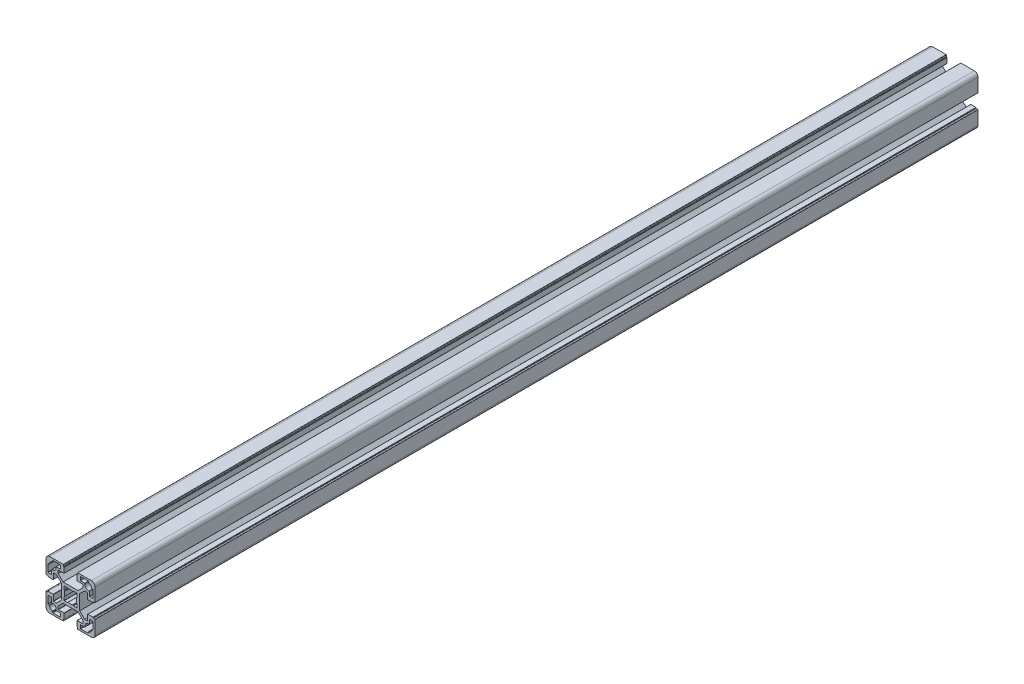
from build123d import *

# Parameters (mm, degrees)
EXTRUDE_707_DEPTH = 360


with BuildPart() as part:
    # Model → Extrude 707 (new, symmetric)
    with BuildSketch(Plane.XY):
        with BuildLine():
            Line((7.5, 6.0858), (11.4642, 10.05))
            Line((11.4642, 10.05), (13.8, 10.05))
            ThreePointArc((13.8, 10.05), (13.941421356, 9.991421356), (14, 9.85))
            Line((14, 9.85), (14, 5.35))
            ThreePointArc((14, 5.35), (14.058578644, 5.208578644), (14.2, 5.15))
            Line((14.2, 5.15), (18.3, 5.15))
            ThreePointArc((18.3, 5.15), (18.441421356, 5.208578644), (18.5, 5.35))
            Line((18.5, 5.35), (18.5, 5.6))
            ThreePointArc((18.5, 5.6), (18.558578644, 5.741421356), (18.7, 5.8))
            Line((18.7, 5.8), (19.8, 5.8))
            ThreePointArc((19.8, 5.8), (19.941421356, 5.858578644), (20, 6))
            Line((20, 6), (20, 17))
            ThreePointArc((20, 17), (19.121320344, 19.121320344), (17, 20))
            Line((17, 20), (6, 20))
            ThreePointArc((6, 20), (5.858578644, 19.941421356), (5.8, 19.8))
            Line((5.8, 19.8), (5.8, 18.7))
            ThreePointArc((5.8, 18.7), (5.741421356, 18.558578644), (5.6, 18.5))
            Line((5.6, 18.5), (5.35, 18.5))
            ThreePointArc((5.35, 18.5), (5.208578644, 18.441421356), (5.15, 18.3))
            Line((5.15, 18.3), (5.15, 14.2))
            ThreePointArc((5.15, 14.2), (5.208578644, 14.058578644), (5.35, 14))
            Line((5.35, 14), (9.85, 14))
            ThreePointArc((9.85, 14), (9.991421356, 13.941421356), (10.05, 13.8))
            Line((10.05, 13.8), (10.05, 11.4642))
            Line((10.05, 11.4642), (6.0858, 7.5))
            Line((6.0858, 7.5), (-6.0858, 7.5))
            Line((-6.0858, 7.5), (-10.05, 11.4642))
            Line((-10.05, 11.4642), (-10.05, 13.8))
            ThreePointArc((-10.05, 13.8), (-9.991421356, 13.941421356), (-9.85, 14))
            Line((-9.85, 14), (-5.35, 14))
            ThreePointArc((-5.35, 14), (-5.208578644, 14.058578644), (-5.15, 14.2))
            Line((-5.15, 14.2), (-5.15, 18.3))
            ThreePointArc((-5.15, 18.3), (-5.208578644, 18.441421356), (-5.35, 18.5))
            Line((-5.35, 18.5), (-5.6, 18.5))
            ThreePointArc((-5.6, 18.5), (-5.741421356, 18.558578644), (-5.8, 18.7))
            Line((-5.8, 18.7), (-5.8, 19.8))
            ThreePointArc((-5.8, 19.8), (-5.858578644, 19.941421356), (-6, 20))
            Line((-6, 20), (-17, 20))
            ThreePointArc((-17, 20), (-19.121320344, 19.121320344), (-20, 17))
            Line((-20, 17), (-20, 6))
            ThreePointArc((-20, 6), (-19.941421356, 5.858578644), (-19.8, 5.8))
            Line((-19.8, 5.8), (-18.7, 5.8))
            ThreePointArc((-18.7, 5.8), (-18.558578644, 5.741421356), (-18.5, 5.6))
            Line((-18.5, 5.6), (-18.5, 5.35))
            ThreePointArc((-18.5, 5.35), (-18.441421356, 5.208578644), (-18.3, 5.15))
            Line((-18.3, 5.15), (-14.2, 5.15))
            ThreePointArc((-14.2, 5.15), (-14.058578644, 5.208578644), (-14, 5.35))
            Line((-14, 5.35), (-14, 9.85))
            ThreePointArc((-14, 9.85), (-13.941421356, 9.991421356), (-13.8, 10.05))
            Line((-13.8, 10.05), (-11.4642, 10.05))
            Line((-11.4642, 10.05), (-7.5, 6.0858))
            Line((-7.5, 6.0858), (-7.5, -6.0858))
            Line((-7.5, -6.0858), (-11.4642, -10.05))
            Line((-11.4642, -10.05), (-13.8, -10.05))
            ThreePointArc((-13.8, -10.05), (-13.941421356, -9.991421356), (-14, -9.85))
            Line((-14, -9.85), (-14, -5.35))
            ThreePointArc((-14, -5.35), (-14.058578644, -5.208578644), (-14.2, -5.15))
            Line((-14.2, -5.15), (-18.3, -5.15))
            ThreePointArc((-18.3, -5.15), (-18.441421356, -5.208578644), (-18.5, -5.35))
            Line((-18.5, -5.35), (-18.5, -5.6))
            ThreePointArc((-18.5, -5.6), (-18.558578644, -5.741421356), (-18.7, -5.8))
            Line((-18.7, -5.8), (-19.8, -5.8))
            ThreePointArc((-19.8, -5.8), (-19.941421356, -5.858578644), (-20, -6))
            Line((-20, -6), (-20, -17))
            ThreePointArc((-20, -17), (-19.121320344, -19.121320344), (-17, -20))
            Line((-17, -20), (-6, -20))
            ThreePointArc((-6, -20), (-5.858578644, -19.941421356), (-5.8, -19.8))
            Line((-5.8, -19.8), (-5.8, -18.7))
            ThreePointArc((-5.8, -18.7), (-5.741421356, -18.558578644), (-5.6, -18.5))
            Line((-5.6, -18.5), (-5.35, -18.5))
            ThreePointArc((-5.35, -18.5), (-5.208578644, -18.441421356), (-5.15, -18.3))
            Line((-5.15, -18.3), (-5.15, -14.2))
            ThreePointArc((-5.15, -14.2), (-5.208578644, -14.058578644), (-5.35, -14))
            Line((-5.35, -14), (-9.85, -14))
            ThreePointArc((-9.85, -14), (-9.991421356, -13.941421356), (-10.05, -13.8))
            Line((-10.05, -13.8), (-10.05, -11.4642))
            Line((-10.05, -11.4642), (-6.0858, -7.5))
            Line((-6.0858, -7.5), (6.0858, -7.5))
            Line((6.0858, -7.5), (10.05, -11.4642))
            Line((10.05, -11.4642), (10.05, -13.8))
            ThreePointArc((10.05, -13.8), (9.991421356, -13.941421356), (9.85, -14))
            Line((9.85, -14), (5.35, -14))
            ThreePointArc((5.35, -14), (5.208578644, -14.058578644), (5.15, -14.2))
            Line((5.15, -14.2), (5.15, -18.3))
            ThreePointArc((5.15, -18.3), (5.208578644, -18.441421356), (5.35, -18.5))
            Line((5.35, -18.5), (5.6, -18.5))
            ThreePointArc((5.6, -18.5), (5.741421356, -18.558578644), (5.8, -18.7))
            Line((5.8, -18.7), (5.8, -19.8))
            ThreePointArc((5.8, -19.8), (5.858578644, -19.941421356), (6, -20))
            Line((6, -20), (17, -20))
            ThreePointArc((17, -20), (19.121320344, -19.121320344), (20, -17))
            Line((20, -17), (20, -6))
            ThreePointArc((20, -6), (19.941421356, -5.858578644), (19.8, -5.8))
            Line((19.8, -5.8), (18.7, -5.8))
            ThreePointArc((18.7, -5.8), (18.558578644, -5.741421356), (18.5, -5.6))
            Line((18.5, -5.6), (18.5, -5.35))
            ThreePointArc((18.5, -5.35), (18.441421356, -5.208578644), (18.3, -5.15))
            Line((18.3, -5.15), (14.2, -5.15))
            ThreePointArc((14.2, -5.15), (14.058578644, -5.208578644), (14, -5.35))
            Line((14, -5.35), (14, -9.85))
            ThreePointArc((14, -9.85), (13.941421356, -9.991421356), (13.8, -10.05))
            Line((13.8, -10.05), (11.4642, -10.05))
            Line((11.4642, -10.05), (7.5, -6.0858))
            Line((7.5, -6.0858), (7.5, 6.0858))
        make_face()
        with BuildLine():
            Line((15.7, -8), (18.3, -8))
            ThreePointArc((18.3, -8), (18.441421356, -8.058578644), (18.5, -8.2))
            Line((18.5, -8.2), (18.5, -14.3))
            ThreePointArc((18.5, -14.3), (18.441421356, -14.441421356), (18.3, -14.5))
            Line((18.3, -14.5), (17.443212531, -14.5))
            ThreePointArc((17.443212531, -14.5), (17.306669249, -14.55386331), (17.243672698, -14.686440678))
            ThreePointArc((17.243672698, -14.686440678), (16.444543648, -16.444543648), (14.686440678, -17.243672698))
            ThreePointArc((14.686440678, -17.243672698), (14.55386331, -17.306669249), (14.5, -17.443212531))
            Line((14.5, -17.443212531), (14.5, -18.3))
            ThreePointArc((14.5, -18.3), (14.441421356, -18.441421356), (14.3, -18.5))
            Line((14.3, -18.5), (8.2, -18.5))
            ThreePointArc((8.2, -18.5), (8.058578644, -18.441421356), (8, -18.3))
            Line((8, -18.3), (8, -15.7))
            ThreePointArc((8, -15.7), (8.058578644, -15.558578644), (8.2, -15.5))
            Line((8.2, -15.5), (11.55, -15.5))
            ThreePointArc((11.55, -15.5), (11.691421356, -15.441421356), (11.75, -15.3))
            Line((11.75, -15.3), (11.75, -14.5))
            ThreePointArc((11.75, -14.5), (12.555456352, -12.555456352), (14.5, -11.75))
            Line((14.5, -11.75), (15.3, -11.75))
            ThreePointArc((15.3, -11.75), (15.441421356, -11.691421356), (15.5, -11.55))
            Line((15.5, -11.55), (15.5, -8.2))
            ThreePointArc((15.5, -8.2), (15.558578644, -8.058578644), (15.7, -8))
        make_face(mode=Mode.SUBTRACT)
        with BuildLine():
            Line((-18.3, -8), (-15.7, -8))
            ThreePointArc((-15.7, -8), (-15.558578644, -8.058578644), (-15.5, -8.2))
            Line((-15.5, -8.2), (-15.5, -11.55))
            ThreePointArc((-15.5, -11.55), (-15.441421356, -11.691421356), (-15.3, -11.75))
            Line((-15.3, -11.75), (-14.5, -11.75))
            ThreePointArc((-14.5, -11.75), (-12.555456352, -12.555456352), (-11.75, -14.5))
            Line((-11.75, -14.5), (-11.75, -15.3))
            ThreePointArc((-11.75, -15.3), (-11.691421356, -15.441421356), (-11.55, -15.5))
            Line((-11.55, -15.5), (-8.2, -15.5))
            ThreePointArc((-8.2, -15.5), (-8.058578644, -15.558578644), (-8, -15.7))
            Line((-8, -15.7), (-8, -18.3))
            ThreePointArc((-8, -18.3), (-8.058578644, -18.441421356), (-8.2, -18.5))
            Line((-8.2, -18.5), (-14.3, -18.5))
            ThreePointArc((-14.3, -18.5), (-14.441421356, -18.441421356), (-14.5, -18.3))
            Line((-14.5, -18.3), (-14.5, -17.443212531))
            ThreePointArc((-14.5, -17.443212531), (-14.55386331, -17.306669249), (-14.686440678, -17.243672698))
            ThreePointArc((-14.686440678, -17.243672698), (-16.444543648, -16.444543648), (-17.243672698, -14.686440678))
            ThreePointArc((-17.243672698, -14.686440678), (-17.306669249, -14.55386331), (-17.443212531, -14.5))
            Line((-17.443212531, -14.5), (-18.3, -14.5))
            ThreePointArc((-18.3, -14.5), (-18.441421356, -14.441421356), (-18.5, -14.3))
            Line((-18.5, -14.3), (-18.5, -8.2))
            ThreePointArc((-18.5, -8.2), (-18.441421356, -8.058578644), (-18.3, -8))
        make_face(mode=Mode.SUBTRACT)
        with BuildLine():
            Line((-5, 5.2), (-2.261, 5.2))
            Line((-2.261, 5.2), (-2.071925246, 4.765191727))
            ThreePointArc((-2.071925246, 4.765191727), (-1.965379386, 4.66030673), (-1.815880292, 4.658602662))
            ThreePointArc((-1.815880292, 4.658602662), (0, 5), (1.815880292, 4.658602662))
            ThreePointArc((1.815880292, 4.658602662), (1.965379386, 4.66030673), (2.071925246, 4.765191727))
            Line((2.071925246, 4.765191727), (2.261, 5.2))
            Line((2.261, 5.2), (5, 5.2))
            ThreePointArc((5, 5.2), (5.141421356, 5.141421356), (5.2, 5))
            Line((5.2, 5), (5.2, 2.261))
            Line((5.2, 2.261), (4.765191727, 2.071925246))
            ThreePointArc((4.765191727, 2.071925246), (4.66030673, 1.965379386), (4.658602662, 1.815880292))
            ThreePointArc((4.658602662, 1.815880292), (5, 0), (4.658602662, -1.815880292))
            ThreePointArc((4.658602662, -1.815880292), (4.66030673, -1.965379386), (4.765191727, -2.071925246))
            Line((4.765191727, -2.071925246), (5.2, -2.261))
            Line((5.2, -2.261), (5.2, -5))
            ThreePointArc((5.2, -5), (5.141421356, -5.141421356), (5, -5.2))
            Line((5, -5.2), (2.261, -5.2))
            Line((2.261, -5.2), (2.071925246, -4.765191727))
            ThreePointArc((2.071925246, -4.765191727), (1.965379386, -4.66030673), (1.815880292, -4.658602662))
            ThreePointArc((1.815880292, -4.658602662), (0, -5), (-1.815880292, -4.658602662))
            ThreePointArc((-1.815880292, -4.658602662), (-1.965379386, -4.66030673), (-2.071925246, -4.765191727))
            Line((-2.071925246, -4.765191727), (-2.261, -5.2))
            Line((-2.261, -5.2), (-5, -5.2))
            ThreePointArc((-5, -5.2), (-5.141421356, -5.141421356), (-5.2, -5))
            Line((-5.2, -5), (-5.2, -2.261))
            Line((-5.2, -2.261), (-4.765191727, -2.071925246))
            ThreePointArc((-4.765191727, -2.071925246), (-4.66030673, -1.965379386), (-4.658602662, -1.815880292))
            ThreePointArc((-4.658602662, -1.815880292), (-5, 0), (-4.658602662, 1.815880292))
            ThreePointArc((-4.658602662, 1.815880292), (-4.66030673, 1.965379386), (-4.765191727, 2.071925246))
            Line((-4.765191727, 2.071925246), (-5.2, 2.261))
            Line((-5.2, 2.261), (-5.2, 5))
            ThreePointArc((-5.2, 5), (-5.141421356, 5.141421356), (-5, 5.2))
        make_face(mode=Mode.SUBTRACT)
        with BuildLine():
            Line((11.55, 15.5), (8.2, 15.5))
            ThreePointArc((8.2, 15.5), (8.058578644, 15.558578644), (8, 15.7))
            Line((8, 15.7), (8, 18.3))
            ThreePointArc((8, 18.3), (8.058578644, 18.441421356), (8.2, 18.5))
            Line((8.2, 18.5), (14.3, 18.5))
            ThreePointArc((14.3, 18.5), (14.441421356, 18.441421356), (14.5, 18.3))
            Line((14.5, 18.3), (14.5, 17.443212531))
            ThreePointArc((14.5, 17.443212531), (14.55386331, 17.306669249), (14.686440678, 17.243672698))
            ThreePointArc((14.686440678, 17.243672698), (16.444543648, 16.444543648), (17.243672698, 14.686440678))
            ThreePointArc((17.243672698, 14.686440678), (17.306669249, 14.55386331), (17.443212531, 14.5))
            Line((17.443212531, 14.5), (18.3, 14.5))
            ThreePointArc((18.3, 14.5), (18.441421356, 14.441421356), (18.5, 14.3))
            Line((18.5, 14.3), (18.5, 8.2))
            ThreePointArc((18.5, 8.2), (18.441421356, 8.058578644), (18.3, 8))
            Line((18.3, 8), (15.7, 8))
            ThreePointArc((15.7, 8), (15.558578644, 8.058578644), (15.5, 8.2))
            Line((15.5, 8.2), (15.5, 11.55))
            ThreePointArc((15.5, 11.55), (15.441421356, 11.691421356), (15.3, 11.75))
            Line((15.3, 11.75), (14.5, 11.75))
            ThreePointArc((14.5, 11.75), (12.555456352, 12.555456352), (11.75, 14.5))
            Line((11.75, 14.5), (11.75, 15.3))
            ThreePointArc((11.75, 15.3), (11.691421356, 15.441421356), (11.55, 15.5))
        make_face(mode=Mode.SUBTRACT)
        with BuildLine():
            Line((-14.5, 11.75), (-15.3, 11.75))
            ThreePointArc((-15.3, 11.75), (-15.441421356, 11.691421356), (-15.5, 11.55))
            Line((-15.5, 11.55), (-15.5, 8.2))
            ThreePointArc((-15.5, 8.2), (-15.558578644, 8.058578644), (-15.7, 8))
            Line((-15.7, 8), (-18.3, 8))
            ThreePointArc((-18.3, 8), (-18.441421356, 8.058578644), (-18.5, 8.2))
            Line((-18.5, 8.2), (-18.5, 14.3))
            ThreePointArc((-18.5, 14.3), (-18.441421356, 14.441421356), (-18.3, 14.5))
            Line((-18.3, 14.5), (-17.443212531, 14.5))
            ThreePointArc((-17.443212531, 14.5), (-17.306669249, 14.55386331), (-17.243672698, 14.686440678))
            ThreePointArc((-17.243672698, 14.686440678), (-16.444543648, 16.444543648), (-14.686440678, 17.243672698))
            ThreePointArc((-14.686440678, 17.243672698), (-14.55386331, 17.306669249), (-14.5, 17.443212531))
            Line((-14.5, 17.443212531), (-14.5, 18.3))
            ThreePointArc((-14.5, 18.3), (-14.441421356, 18.441421356), (-14.3, 18.5))
            Line((-14.3, 18.5), (-8.2, 18.5))
            ThreePointArc((-8.2, 18.5), (-8.058578644, 18.441421356), (-8, 18.3))
            Line((-8, 18.3), (-8, 15.7))
            ThreePointArc((-8, 15.7), (-8.058578644, 15.558578644), (-8.2, 15.5))
            Line((-8.2, 15.5), (-11.55, 15.5))
            ThreePointArc((-11.55, 15.5), (-11.691421356, 15.441421356), (-11.75, 15.3))
            Line((-11.75, 15.3), (-11.75, 14.5))
            ThreePointArc((-11.75, 14.5), (-12.555456352, 12.555456352), (-14.5, 11.75))
        make_face(mode=Mode.SUBTRACT)
    extrude(amount=EXTRUDE_707_DEPTH, both=True)


solid = part.part
